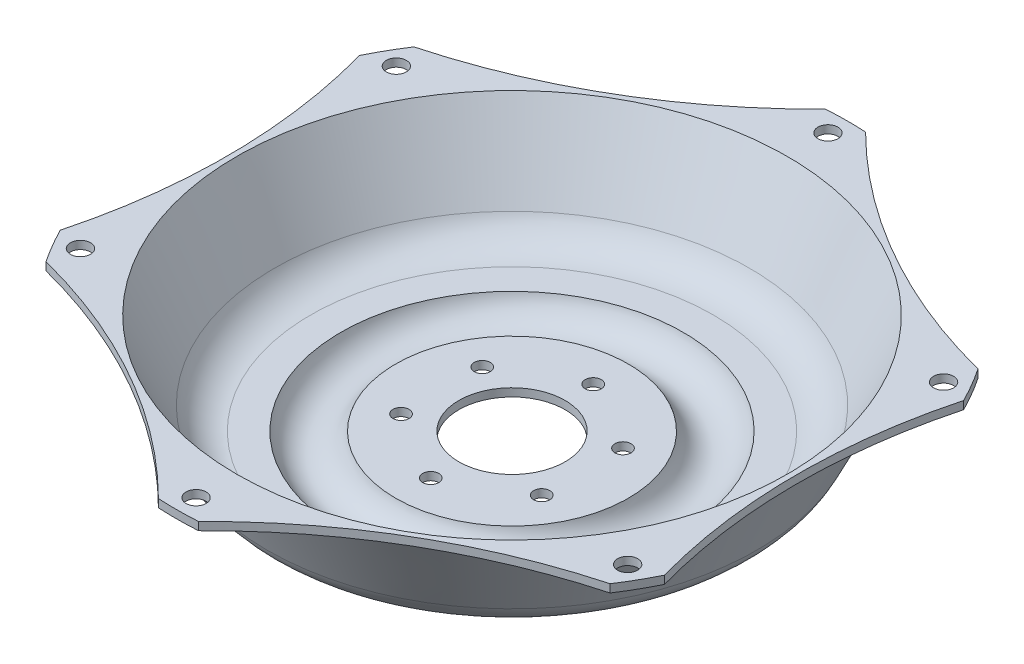
from build123d import *

# Parameters (mm, degrees)
THICKEN1_T1        = 8
CUT_EXTRUDE1_DEPTH = 10
CIRPATTERN1_COUNT  = 6
SKETCH3_R          = 8
CUT_EXTRUDE2_DEPTH = 10
CIRPATTERN2_COUNT  = 6


with BuildPart() as body_1:
    # Surface-Revolve1: a surface, the sketch's curves turned about an axis
    with BuildLine(Plane.XY, mode=Mode.PRIVATE) as surface_revolve1_1_path:
        Line((53, 0), (116, 0))
        ThreePointArc((116, 0), (143.354158733, -20.5), (170.708317466, 0))
        Line((170.708317466, 0), (200.708317466, 0))
        ThreePointArc((200.708317466, 0), (221.905088036, 6.078076154), (236.660079318, 22.465154128))
        Line((236.660079318, 22.465154128), (274.476350399, 100))
        Line((274.476350399, 100), (335, 100))
    surface_revolve1_1 = Shell.revolve(surface_revolve1_1_path.wire(), 360, Axis((0, 0, 0), (0, 1, 0)))
    add(Solid.thicken(surface_revolve1_1, THICKEN1_T1))

    # Sketch2 → Cut-Extrude1 (cut)
    with BuildSketch(Plane.XZ.offset(-92)):
        with BuildLine():
            ThreePointArc((-278.640810912, 185.968541679), (-138.384551206, 242.808900604), (-18, 334.516068373))
            ThreePointArc((-18, 334.516068373), (-165.878071475, 291.048905519), (-278.640810912, 185.968541679))
        make_face()
        with BuildLine():
            ThreePointArc((0, 325), (-10, 315), (0, 305))
            Line((0, 305), (0, 325))
        make_face()
        with BuildLine():
            Line((0, 325), (0, 305))
            ThreePointArc((0, 305), (7.071067812, 307.928932188), (10, 315))
            ThreePointArc((10, 315), (7.071067812, 322.071067812), (0, 325))
        make_face()
    cut_extrude1 = extrude(amount=-CUT_EXTRUDE1_DEPTH, mode=Mode.SUBTRACT)

    # CirPattern1: Cut-Extrude1 ×6 about axis
    cirpattern1_axis = Axis((0, 0, 0), (0, 1, 0))
    for i in range(1, CIRPATTERN1_COUNT):
        add(cut_extrude1.rotate(cirpattern1_axis, i * 360 / CIRPATTERN1_COUNT), mode=Mode.SUBTRACT)

    # Sketch3 → Cut-Extrude2 (cut)
    with BuildSketch(Plane.XZ.offset(8)):
        with Locations(Location((0, 81, 0), (0, 0, 270))):
            Circle(SKETCH3_R)
    cut_extrude2 = extrude(amount=-CUT_EXTRUDE2_DEPTH, mode=Mode.SUBTRACT)

    # CirPattern2: Cut-Extrude2 ×6 about axis
    cirpattern2_axis = Axis((0, 0, 0), (0, 1, 0))
    for i in range(1, CIRPATTERN2_COUNT):
        add(cut_extrude2.rotate(cirpattern2_axis, i * 360 / CIRPATTERN2_COUNT), mode=Mode.SUBTRACT)


solid = body_1.part
